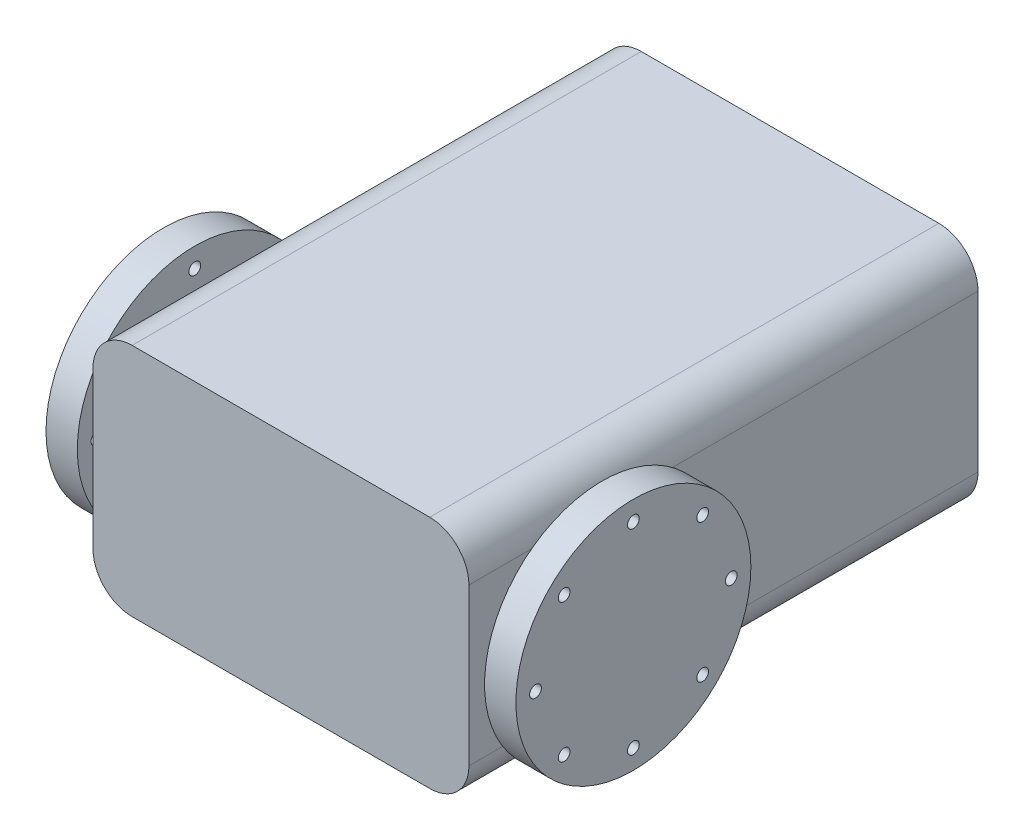
from build123d import *

# Parameters (mm, degrees)
BOSS_EXTRUDE1_DEPTH = 32.5
BOSS_EXTRUDE2_START = 2
SKETCH2_R           = 15
BOSS_EXTRUDE2_DEPTH = 4
SKETCH3_R           = 7.5
BOSS_EXTRUDE3_DEPTH = 50
BOSS_EXTRUDE4_START = 4
SKETCH4_R           = 15
BOSS_EXTRUDE4_DEPTH = 4
SKETCH5_R           = 0.75
CUT_EXTRUDE1_DEPTH  = 4
CUT_EXTRUDE2_START  = -4
SKETCH6_R           = 0.75
CUT_EXTRUDE2_DEPTH  = 4


with BuildPart() as part:
    # Sketch1 → Boss-Extrude1 (new, symmetric)
    with BuildSketch(Plane.XY):
        with BuildLine():
            Line((-19, -15), (19, -15))
            ThreePointArc((19, -15), (22.535533906, -13.535533906), (24, -10))
            Line((24, -10), (24, 10))
            ThreePointArc((24, 10), (22.535533906, 13.535533906), (19, 15))
            Line((19, 15), (-19, 15))
            ThreePointArc((-19, 15), (-22.535533906, 13.535533906), (-24, 10))
            Line((-24, 10), (-24, -10))
            ThreePointArc((-24, -10), (-22.535533906, -13.535533906), (-19, -15))
        make_face()
    extrude(amount=BOSS_EXTRUDE1_DEPTH, both=True)



with BuildPart() as body_2:
    # Sketch2 → Boss-Extrude2 (new body)
    with BuildSketch(Plane(origin=(24, 0, 0), x_dir=(0, 0, -1), z_dir=(1, 0, 0)).offset(BOSS_EXTRUDE2_START)):
        with Locations((-17.5, 0)):
            Circle(SKETCH2_R)
    extrude(amount=BOSS_EXTRUDE2_DEPTH)


with BuildPart() as part_1:
    add(part.part)

    add(body_2.part)  # Boss-Extrude3 merges body 2
    # Sketch3 → Boss-Extrude3 (add)
    with BuildSketch(Plane.ZY.offset(-26)):
        with Locations(Location((17.5, 0, 0), (0, 0, 180))):
            Circle(SKETCH3_R)
    boss_extrude3 = extrude(amount=BOSS_EXTRUDE3_DEPTH)

    # Mirror3: Boss-Extrude3 across plane
    add(boss_extrude3.mirror(Plane(origin=(0, 0, 0), x_dir=(0, 0, 1), z_dir=(1, 0, 0))))

    # Sketch4 → Boss-Extrude4 (add)
    with BuildSketch(Plane.ZY.offset(26).offset(BOSS_EXTRUDE4_START)):
        with Locations(Location((17.5, 0, 0), (0, 0, 180))):
            Circle(SKETCH4_R)
    extrude(amount=-BOSS_EXTRUDE4_DEPTH)

    # Sketch5 → Cut-Extrude1 (cut)
    with BuildSketch(Plane(origin=(30, 0, 0), x_dir=(0, 0, -1), z_dir=(1, 0, 0))):
        with Locations((-17.5, 12.5)):
            Circle(SKETCH5_R)
        with Locations((-8.661165235, 8.838834765)):
            Circle(SKETCH5_R)
        with Locations((-5, 0)):
            Circle(SKETCH5_R)
        with Locations((-8.661165235, -8.838834765)):
            Circle(SKETCH5_R)
        with Locations((-17.5, -12.5)):
            Circle(SKETCH5_R)
        with Locations((-26.338834765, -8.838834765)):
            Circle(SKETCH5_R)
        with Locations((-30, 0)):
            Circle(SKETCH5_R)
        with Locations((-26.338834765, 8.838834765)):
            Circle(SKETCH5_R)
    extrude(amount=-CUT_EXTRUDE1_DEPTH, mode=Mode.SUBTRACT)

    # Sketch6 → Cut-Extrude2 (cut)
    with BuildSketch(Plane.ZY.offset(30).offset(CUT_EXTRUDE2_START)):
        with Locations(Location((17.5, 12.5, 0), (0, 0, 180))):
            Circle(SKETCH6_R)
        with Locations(Location((26.338834765, 8.838834765, 0), (0, 0, 180))):
            Circle(SKETCH6_R)
        with Locations(Location((30, 0, 0), (0, 0, 180))):
            Circle(SKETCH6_R)
        with Locations(Location((26.338834765, -8.838834765, 0), (0, 0, 180))):
            Circle(SKETCH6_R)
        with Locations(Location((17.5, -12.5, 0), (0, 0, 180))):
            Circle(SKETCH6_R)
        with Locations(Location((8.661165235, -8.838834765, 0), (0, 0, 180))):
            Circle(SKETCH6_R)
        with Locations(Location((5, 0, 0), (0, 0, 180))):
            Circle(SKETCH6_R)
        with Locations(Location((8.661165235, 8.838834765, 0), (0, 0, 180))):
            Circle(SKETCH6_R)
    extrude(amount=CUT_EXTRUDE2_DEPTH, mode=Mode.SUBTRACT)


solid = part_1.part
